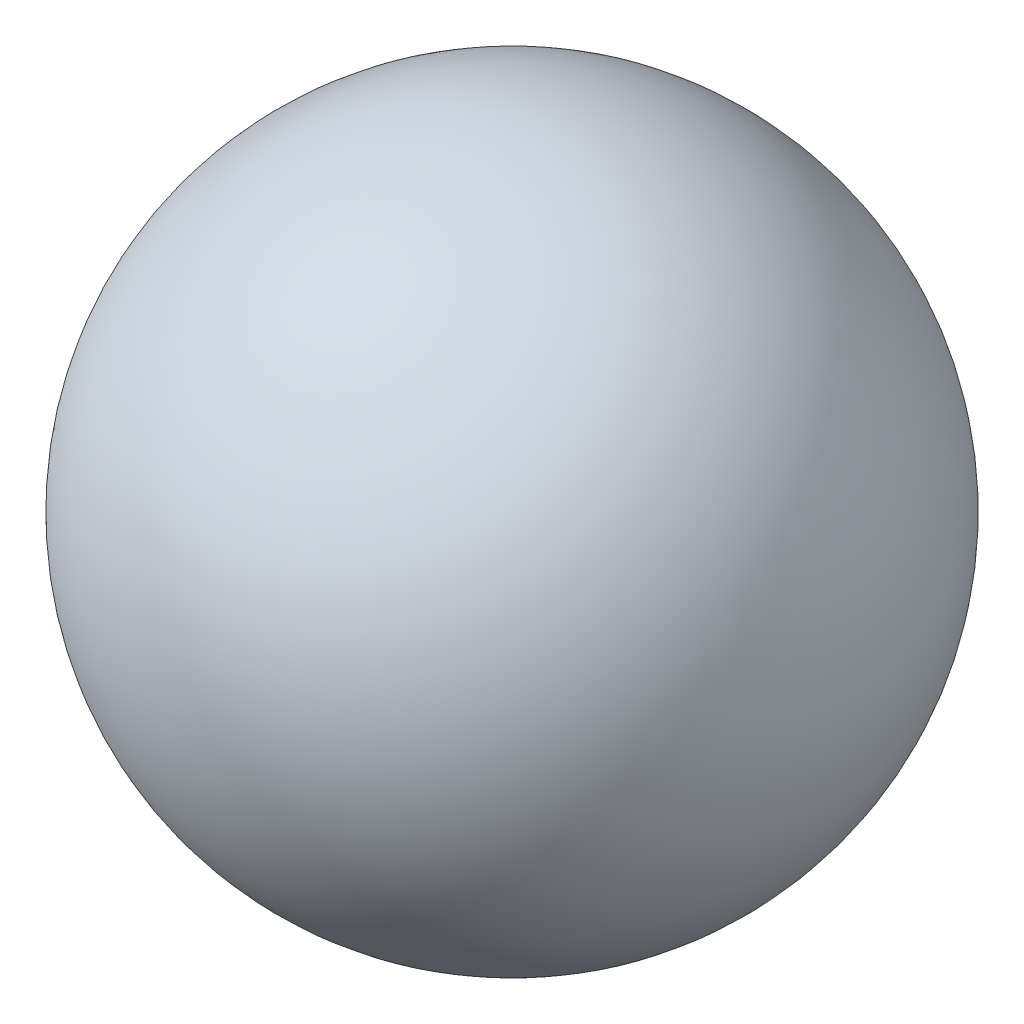
from build123d import *


with BuildPart() as part:
    # Sketch1 → Revolve1 (revolve)
    with BuildSketch(Plane.XY):
        with BuildLine():
            Line((0, 0), (0, -63))
            ThreePointArc((0, -63), (31.5, -31.5), (0, 0))
        make_face()
    revolve(axis=Axis((0, 0, 0), (0, -1, 0)))


solid = part.part
